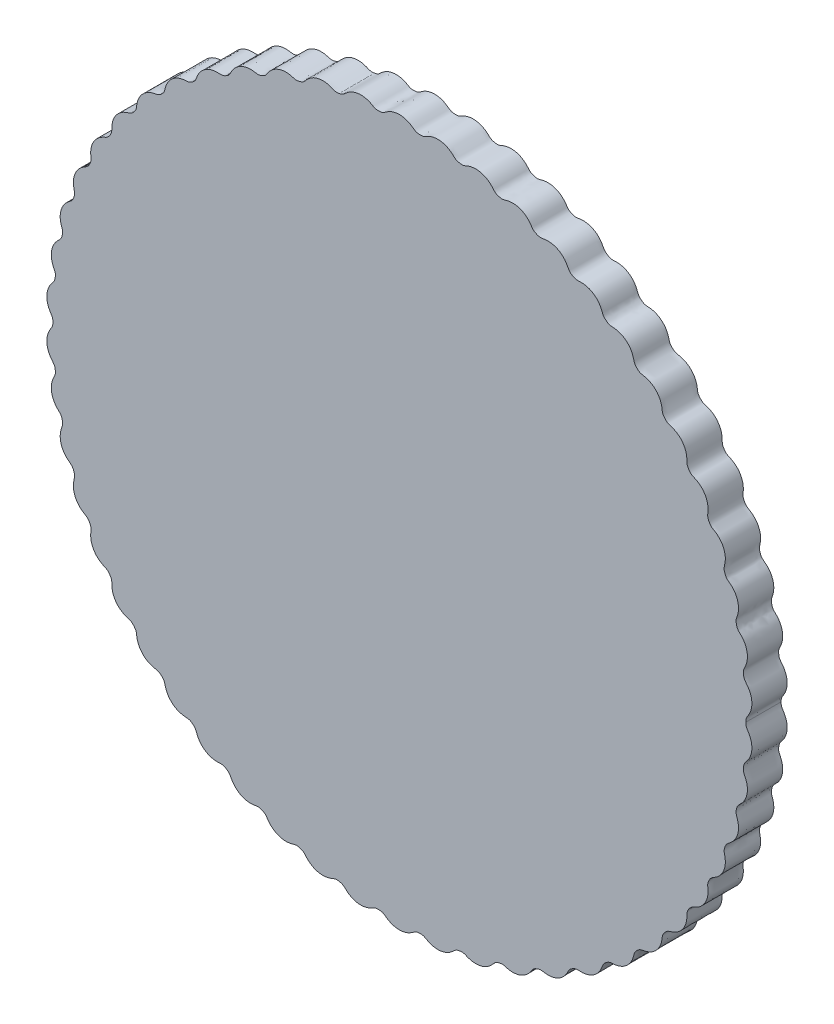
from build123d import *

# Parameters (mm, degrees)
BOSS_EXTRUDE1_DEPTH = 20


with BuildPart() as part:
    # Sketch2 → Boss-Extrude1 (new body)
    with BuildSketch(Plane.XY):
        with BuildLine():
            add(Edge.make_bspline(
                [(196.3825, 0), (196.3825, 0.243288035), (196.398243649, 0.729922422), (196.467671206, 1.796569214), (196.897631399, 2.707361858), (197.506180009, 3.679856694), (198.077913743, 4.570194444), (198.620032332, 5.582427543), (199.095198871, 6.684318292), (199.474773477, 7.892329781), (199.732776133, 9.192715808), (199.850080949, 10.534230409), (199.818921359, 11.900253607), (199.63224692, 13.274365047), (199.284989462, 14.637619624), (198.800550787, 15.904112197), (198.204869255, 17.065047303), (197.520000345, 18.115085043), (196.788829318, 19.067982816), (195.998314098, 19.973352886), (195.36115854, 21.009956982), (195.117532921, 22.191405466), (194.981257086, 23.349056333), (194.940733167, 24.50687874), (195.247204528, 25.588147603), (195.745426342, 26.567704845), (196.207345247, 27.540435347), (196.629204669, 28.600928228), (196.972879737, 29.75357144), (197.209802714, 30.996147902), (197.315021839, 32.318318085), (197.275828509, 33.664080323), (197.086275962, 35.017400133), (196.741348843, 36.360472168), (196.238169422, 37.674232344), (195.60997998, 38.875906815), (194.883544728, 39.959834995), (194.081413646, 40.923287129), (193.244542966, 41.784799015), (192.354305891, 42.592401049), (191.60103892, 43.547794657), (191.217637584, 44.706812578), (190.942703185, 45.866852023), (190.76515684, 47.074658473), (191.009520925, 48.266494985), (191.442614701, 49.387732192), (191.803823829, 50.533194209), (192.088237818, 51.754162255), (192.250937991, 53.048819402), (192.272998064, 54.404605839), (192.133041129, 55.804451325), (191.838509632, 57.159467342), (191.400531154, 58.453909126), (190.831578604, 59.674116122), (190.144162465, 60.808428296), (189.374773062, 61.812504342), (188.550348475, 62.688302851), (187.69741279, 63.446663741), (186.848066326, 64.108618645), (185.963214568, 64.76038142), (185.20406917, 65.589094489), (184.720652935, 66.641949453), (184.322880675, 67.737624605), (184.010359441, 68.902744368), (184.114515222, 70.115042822), (184.41461647, 71.278892874), (184.640354079, 72.458584272), (184.781121365, 73.704296587), (184.792410439, 75.00909677), (184.656929354, 76.358272551), (184.355403968, 77.732406978), (183.905557581, 79.044066717), (183.320264352, 80.278910322), (182.613501814, 81.424815068), (181.799047958, 82.47165343), (180.918294862, 83.379619545), (179.9977707, 84.153786396), (179.062561951, 84.80799972), (178.142110185, 85.366875619), (177.18757644, 85.911506387), (176.337356395, 86.646484594), (175.734979847, 87.636099329), (175.212697059, 88.678187378), (174.767026833, 89.799147517), (174.729739091, 91.01534059), (174.892696417, 92.206160733), (174.979953856, 93.404082017), (174.975150952, 94.657713355), (174.834885638, 95.955001527), (174.543690879, 97.27932627), (174.08467703, 98.609164332), (173.485597942, 99.859731118), (172.760905664, 101.018276756), (171.92589058, 102.074383182), (170.995413253, 103.019590876), (170.015207063, 103.819168455), (169.01103187, 104.481234334), (168.006197137, 105.022452992), (167.027087604, 105.470692046), (166.015780302, 105.900825611), (165.085983379, 106.532129635), (164.372792628, 107.445121301), (163.733062291, 108.419529792), (163.160269998, 109.481171244), (162.982042984, 110.684812013), (163.005652671, 111.886498446), (162.953249934, 113.086449785), (162.80294179, 114.331046934), (162.513018935, 115.603279499), (162.070048412, 116.884843983), (161.459753475, 118.1524019), (160.719543203, 119.324963964), (159.865252095, 120.391544292), (158.913276612, 121.34357037), (157.879358924, 122.174365084), (156.812955246, 122.854741212), (155.73870877, 123.395752814), (154.677836718, 123.816657753), (153.653310196, 124.148198295), (152.598905533, 124.458017839), (151.60210564, 124.977110377), (150.787745367, 125.801132327), (150.039218736, 126.694684058), (149.34705041, 127.682649944), (149.030294339, 128.85746123), (148.914237106, 130.053763208), (148.722882849, 131.239517319), (148.429102125, 132.458249236), (147.993442439, 133.68822143), (147.404686569, 134.909694695), (146.651363735, 136.097830921), (145.780032353, 137.176531373), (144.807695238, 138.136722722), (143.751633191, 138.971793932), (142.628257105, 139.676940592), (141.49007722, 140.228914349), (140.3602868, 140.641555421), (139.257723905, 140.936454623), (138.201635357, 141.146813137), (137.118392347, 141.332128882), (136.068069494, 141.731990098), (135.163552523, 142.455898849), (134.316352138, 143.256510064), (133.514168168, 144.157439841), (133.063166622, 145.287534338), (132.809011943, 146.462273927), (132.481293906, 147.617795519), (132.048013482, 148.794180947), (131.472508515, 149.965259507), (130.745929211, 151.110123222), (129.859765879, 152.202770253), (128.869096649, 153.173021519), (127.791862718, 154.013838948), (126.645995534, 154.720662385), (125.448352786, 155.290625092), (124.253788623, 155.70673198), (123.083732738, 155.985422258), (121.954389271, 156.150327718), (120.881020483, 156.236659466), (119.78358813, 156.294965335), (118.69394613, 156.570187791), (117.711504503, 157.184193719), (116.777087295, 157.881037527), (115.875735842, 158.682747663), (115.296587844, 159.752842782), (114.907772726, 160.890133645), (114.448122732, 161.999796272), (113.881201983, 163.117926615), (113.173634452, 164.214274712), (112.319057452, 165.26704656), (111.312037462, 166.249428218), (110.215427486, 167.098109314), (109.04786448, 167.808182211), (107.827688047, 168.3771993), (106.571974699, 168.804270286), (105.337180691, 169.078883174), (104.142682338, 169.219853851), (103.001830732, 169.252535504), (101.925697176, 169.213672997), (100.82891637, 169.144180503), (99.714690762, 169.291042288), (98.667610317, 169.786842017), (97.658612675, 170.370494799), (96.670282972, 171.062143541), (95.970820505, 172.057768081), (95.452603006, 173.14223031), (94.867237032, 174.191027688), (94.174342589, 175.235782152), (93.34428113, 176.242573558), (92.373263123, 177.189016605), (91.259004692, 178.047847865), (90.071283739, 178.763481836), (88.829180944, 179.333207681), (87.551196056, 179.756723443), (86.254393477, 180.035127305), (84.996068094, 180.164532525), (83.793280815, 180.165877213), (82.656349131, 180.065893098), (81.592003667, 179.902361885), (80.510706486, 179.706010794), (79.386965261, 179.722525854), (78.289405964, 180.093414542), (77.21947285, 180.555983396), (76.157530362, 181.128217382), (75.347212455, 182.035907229), (74.706600577, 183.052875332), (74.003434695, 184.026624276), (73.193936765, 184.983874349), (72.252606537, 185.887493939), (71.178278875, 186.714809166), (69.971850437, 187.438475808), (68.709080395, 188.011384931), (67.409235121, 188.433059161), (66.090724331, 188.705346271), (64.770369551, 188.831318076), (63.505529485, 188.813765642), (62.310718915, 188.675466159), (61.193082204, 188.444168388), (60.154918278, 188.158179947), (59.103727412, 187.837625571), (57.985667241, 187.723570569), (56.852471699, 187.964532584), (55.736072124, 188.299762059), (54.6148778, 188.744842806), (53.704662614, 189.552323011), (52.950319533, 190.488044241), (52.138862854, 191.373576466), (51.22370851, 192.230376982), (50.183839389, 193.01860485), (49.02073051, 193.715604239), (47.738446941, 194.294319913), (46.417704608, 194.716756576), (45.077695033, 194.98467677), (43.736488937, 195.102053011), (42.41043749, 195.073889206), (41.156187533, 194.909616487), (39.985511435, 194.633543094), (38.902283815, 194.274059573), (37.904340814, 193.869481409), (36.897471816, 193.429058695), (35.800212546, 193.185976029), (34.646705284, 193.293752772), (33.498936637, 193.497109466), (32.333652707, 193.809018019), (31.33584934, 194.505368799), (30.477976253, 195.347189129), (29.569202338, 196.132529332), (28.560767471, 196.877293535), (27.436421902, 197.539470252), (26.200260859, 198.096728081), (24.859462844, 198.522666651), (23.498608996, 198.788918121), (22.136556449, 198.899461118), (20.790792559, 198.860339179), (19.476977016, 198.678420631), (18.250278747, 198.369649132), (17.119568506, 197.959535249), (16.085398774, 197.476727376), (15.141172164, 196.959030714), (14.192241211, 196.404695625), (13.130621391, 196.035872571), (11.972401616, 196.009006546), (10.808785499, 196.077740408), (9.615170429, 196.25225874), (8.54327246, 196.828063144), (7.593470629, 197.5645984), (6.599669085, 198.239126201), (5.511591047, 198.861782433), (4.317973876, 199.388953194), (3.025477627, 199.798933507), (1.644297158, 200.066334884), (0.261735008, 200.172800568), (-1.103941085, 200.124471464), (-2.436063621, 199.929380401), (-3.719876159, 199.596167246), (-4.90243375, 199.147072574), (-5.977887217, 198.608464287), (-6.949013691, 198.00886121), (-7.826754864, 197.385047008), (-8.70491511, 196.724295976), (-9.716538894, 196.234720232), (-10.863808245, 196.073574757), (-12.027535921, 196.006756279), (-13.233340535, 196.041524329), (-14.364837524, 196.488995591), (-15.39372366, 197.110285397), (-16.459113371, 197.664878964), (-17.612120191, 198.157006868), (-18.858867339, 198.542042593), (-20.190220001, 198.799201109), (-21.593104826, 198.904449148), (-22.978678497, 198.84968928), (-24.329509711, 198.643141643), (-25.629976221, 198.29471973), (-26.866424391, 197.814718104), (-27.988849242, 197.231373492), (-28.994502271, 196.571554554), (-29.889452667, 195.863264877), (-30.68883846, 195.141769153), (-31.484352387, 194.383537701), (-32.432299658, 193.77982994), (-33.553103737, 193.486584231), (-34.701205551, 193.285117018), (-35.902893269, 193.179664607), (-37.078687723, 193.492751446), (-38.172744243, 193.990393922), (-39.295314554, 194.417553331), (-40.497657716, 194.772497719), (-41.780674726, 195.010191461), (-43.132879538, 195.111050554), (-44.53849711, 195.052721955), (-45.908344795, 194.837477069), (-47.226063454, 194.475504101), (-48.47728736, 193.978463145), (-49.649650322, 193.358164247), (-50.696763562, 192.648458431), (-51.619016422, 191.876351762), (-52.42568807, 191.068953887), (-53.135908161, 190.259533632), (-53.838017809, 189.41407554), (-54.709469207, 188.704399874), (-55.78865106, 188.283019576), (-56.905600904, 187.949628127), (-58.086920963, 187.705381319), (-59.291112279, 187.879849772), (-60.435543945, 188.247115158), (-61.600114018, 188.541063808), (-62.835533894, 188.754024668), (-64.137470161, 188.841162026), (-65.492240874, 188.784357749), (-66.881582626, 188.563241308), (-68.217179485, 188.190422221), (-69.483965705, 187.677918985), (-70.669026349, 187.038980613), (-71.761449906, 186.286772921), (-72.719091124, 185.460303454), (-73.545471927, 184.586350473), (-74.252955978, 183.690763071), (-74.864405859, 182.804364307), (-75.463616398, 181.883112944), (-76.246787037, 181.077066519), (-77.269752583, 180.533250077), (-78.340445627, 180.07244294), (-79.485422697, 179.692704753), (-80.701726255, 179.726195434), (-81.88105659, 179.958117096), (-83.071877616, 180.114879837), (-84.323667263, 180.182977239), (-85.626916353, 180.118379829), (-86.965931974, 179.904680364), (-88.320209526, 179.523766294), (-89.60349374, 178.998414758), (-90.802216726, 178.342311957), (-91.905087571, 177.570116762), (-92.902799872, 176.696172495), (-93.758015821, 175.764116177), (-94.477355567, 174.800135089), (-95.076068252, 173.828470778), (-95.580523142, 172.877076884), (-96.068625436, 171.892498734), (-96.753139959, 171.000969642), (-97.694020553, 170.350082351), (-98.680488576, 169.780544772), (-99.714613803, 169.291161922), (-100.828957905, 169.144119501), (-101.925678743, 169.21369959), (-103.001837469, 169.252525787), (-104.142679789, 169.219857548), (-105.337181773, 169.078881598), (-106.571974196, 168.80427102), (-107.827688284, 168.377198955), (-109.047864362, 167.808182383), (-110.215427547, 167.098109226), (-111.312037431, 166.249428264), (-112.319057468, 165.267046535), (-113.173634443, 164.214274724), (-113.881201987, 163.117926609), (-114.44812273, 161.999796274), (-114.907772727, 160.890133644), (-115.296587844, 159.752842783), (-115.875735842, 158.682747663), (-116.777087294, 157.881037527), (-117.711504503, 157.184193719), (-118.69394613, 156.570187791), (-119.78358813, 156.294965335), (-120.881020483, 156.236659466), (-121.954389271, 156.150327718), (-123.083732738, 155.985422258), (-124.253788623, 155.70673198), (-125.448352786, 155.290625092), (-126.645995534, 154.720662385), (-127.791862718, 154.013838948), (-128.869096649, 153.173021519), (-129.859765879, 152.202770253), (-130.745929211, 151.110123222), (-131.472508515, 149.965259507), (-132.048013482, 148.794180947), (-132.481293906, 147.617795519), (-132.809011943, 146.462273927), (-133.063166622, 145.287534338), (-133.514168168, 144.157439841), (-134.316352138, 143.256510064), (-135.163552523, 142.455898849), (-136.068069494, 141.731990098), (-137.118392347, 141.332128882), (-138.201635357, 141.146813137), (-139.257723905, 140.936454623), (-140.3602868, 140.641555421), (-141.49007722, 140.228914349), (-142.628257105, 139.676940592), (-143.751633191, 138.971793932), (-144.807695238, 138.136722722), (-145.780032353, 137.176531373), (-146.651363735, 136.097830921), (-147.404686569, 134.909694695), (-147.993442439, 133.68822143), (-148.429102125, 132.458249236), (-148.722882849, 131.239517319), (-148.914237106, 130.053763208), (-149.030294339, 128.85746123), (-149.34705041, 127.682649944), (-150.039218736, 126.694684058), (-150.787745367, 125.801132327), (-151.60210564, 124.977110377), (-152.598905533, 124.458017839), (-153.653310196, 124.148198295), (-154.677836718, 123.816657753), (-155.73870877, 123.395752814), (-156.812955246, 122.854741212), (-157.879358924, 122.174365084), (-158.913276612, 121.34357037), (-159.865252095, 120.391544292), (-160.719543203, 119.324963964), (-161.459753475, 118.1524019), (-162.070048412, 116.884843983), (-162.513018935, 115.603279499), (-162.80294179, 114.331046934), (-162.953249934, 113.086449785), (-163.005652671, 111.886498446), (-162.982042984, 110.684812013), (-163.160269998, 109.481171244), (-163.733062291, 108.419529792), (-164.372792628, 107.445121301), (-165.085983379, 106.532129635), (-166.015780302, 105.900825611), (-167.027087604, 105.470692046), (-168.006197137, 105.022452992), (-169.01103187, 104.481234334), (-170.015207063, 103.819168455), (-170.995413253, 103.019590876), (-171.92589058, 102.074383182), (-172.760905664, 101.018276756), (-173.485597942, 99.859731118), (-174.08467703, 98.609164332), (-174.543690879, 97.27932627), (-174.834885638, 95.955001527), (-174.975150952, 94.657713355), (-174.979953856, 93.404082017), (-174.892696417, 92.206160733), (-174.729739091, 91.01534059), (-174.767026833, 89.799147517), (-175.212697059, 88.678187378), (-175.734979847, 87.636099329), (-176.337356395, 86.646484594), (-177.18757644, 85.911506387), (-178.142110185, 85.366875619), (-179.062561951, 84.80799972), (-179.9977707, 84.153786396), (-180.918294862, 83.379619545), (-181.799047958, 82.47165343), (-182.613501814, 81.424815068), (-183.320264352, 80.278910322), (-183.905557581, 79.044066717), (-184.355403968, 77.732406978), (-184.656929354, 76.35827255), (-184.792410439, 75.00909677), (-184.781121365, 73.704296587), (-184.640354079, 72.458584272), (-184.41461647, 71.278892874), (-184.114515222, 70.115042822), (-184.010359441, 68.902744368), (-184.322880675, 67.737624605), (-184.720652935, 66.641949453), (-185.204069169, 65.589094489), (-185.963214569, 64.760381419), (-186.848066325, 64.108618646), (-187.697412794, 63.446663737), (-188.550348465, 62.688302861), (-189.374773086, 61.812504317), (-190.144162412, 60.808428351), (-190.831578707, 59.674116014), (-191.400530948, 58.453909342), (-191.838510041, 57.159466911), (-192.133040326, 55.804452169), (-192.272999635, 54.404604186), (-192.250934898, 53.048822655), (-192.088244101, 51.754155646), (-191.803810259, 50.533208476), (-191.442645196, 49.387700266), (-191.009458381, 48.26655938), (-190.765267603, 47.074549804), (-190.940413532, 45.881026663), (-191.208296077, 44.746581533), (-191.566214623, 43.644724398), (-192.224019237, 42.733483388), (-193.027222903, 41.983402583), (-193.793978121, 41.227320469), (-194.553106222, 40.375067571), (-195.270282373, 39.409481006), (-195.917903259, 38.322873594), (-196.468985866, 37.11642691), (-196.892433707, 35.838419516), (-197.177175749, 34.501883372), (-197.312406915, 33.121837875), (-197.288907438, 31.71520688), (-197.109595265, 30.371154218), (-196.797702859, 29.104128534), (-196.373448943, 27.924457723), (-195.881740562, 26.828623741), (-195.321326289, 25.765353515), (-194.940402776, 24.609752724), (-194.975804852, 23.403966512), (-195.11017503, 22.246092925), (-195.337755653, 21.110134141), (-195.885323802, 20.128688636), (-196.596017429, 19.290431982), (-197.269812337, 18.450451516), (-197.924866987, 17.51582028), (-198.525096031, 16.473532772), (-199.042190652, 15.319022789), (-199.449486847, 14.056890084), (-199.721704434, 12.738099804), (-199.849357678, 11.378072213), (-199.823463118, 9.99061952), (-199.636818407, 8.598264095), (-199.30269202, 7.280113385), (-198.845799059, 6.065921099), (-198.287497845, 4.926328591), (-197.671817389, 3.933583479), (-196.991915363, 2.858869309), (-196.47913381, 1.915457983), (-196.399929512, 0.763136847), (-196.3825, 0.255087934), (-196.3825, 0)],
                knots=[0.075511734, 0.075511734, 0.075511734, 0.075511734, 0.075511734, 0.076969767, 0.0784278, 0.079799271, 0.081170742, 0.082542213, 0.083913685, 0.085597168, 0.087280652, 0.088964135, 0.090647618, 0.092432737, 0.094217855, 0.096002974, 0.097788092, 0.099315521, 0.10084295, 0.10237038, 0.103897809, 0.105426559, 0.106955309, 0.108413342, 0.109871375, 0.111242846, 0.112614317, 0.113985789, 0.11535726, 0.117040743, 0.118724227, 0.12040771, 0.122091194, 0.123876312, 0.125661431, 0.127446549, 0.129231667, 0.130759097, 0.132286526, 0.133813955, 0.135341384, 0.136870134, 0.138398884, 0.139927634, 0.141456385, 0.142983814, 0.144511243, 0.146038672, 0.147566101, 0.14935122, 0.151136338, 0.152921456, 0.154706575, 0.156390058, 0.158073542, 0.159757025, 0.161440509, 0.16281198, 0.164183451, 0.165554922, 0.166926394, 0.168384427, 0.16984246, 0.17137121, 0.17289996, 0.174427389, 0.175954818, 0.177482247, 0.179009677, 0.180794795, 0.182579913, 0.184365032, 0.18615015, 0.187833634, 0.189517117, 0.191200601, 0.192884084, 0.194255555, 0.195627027, 0.196998498, 0.198369969, 0.199828002, 0.201286035, 0.202814785, 0.204343535, 0.205870964, 0.207398393, 0.208925823, 0.210453252, 0.21223837, 0.214023489, 0.215808607, 0.217593725, 0.219277209, 0.220960692, 0.222644176, 0.224327659, 0.225699131, 0.227070602, 0.228442073, 0.229813544, 0.231271577, 0.23272961, 0.23425836, 0.23578711, 0.23731454, 0.238841969, 0.240369398, 0.241896827, 0.243681945, 0.245467064, 0.247252182, 0.249037301, 0.250720784, 0.252404268, 0.254087751, 0.255771235, 0.257142706, 0.258514177, 0.259885648, 0.26125712, 0.262715152, 0.264173185, 0.265701936, 0.267230686, 0.268758115, 0.270285544, 0.271812973, 0.273340402, 0.275125521, 0.276910639, 0.278695758, 0.280480876, 0.282164359, 0.283847843, 0.285531326, 0.28721481, 0.288586281, 0.289957752, 0.291329224, 0.292700695, 0.294158728, 0.295616761, 0.297145511, 0.298674261, 0.30020169, 0.301729119, 0.303256548, 0.304783978, 0.306569096, 0.308354214, 0.310139333, 0.311924451, 0.313607935, 0.315291418, 0.316974902, 0.318658385, 0.320029856, 0.321401328, 0.322772799, 0.32414427, 0.325602303, 0.327060336, 0.328589086, 0.330117836, 0.331645265, 0.333172695, 0.334700124, 0.336227553, 0.338012671, 0.33979779, 0.341582908, 0.343368027, 0.34505151, 0.346734993, 0.348418477, 0.35010196, 0.351473432, 0.352844903, 0.354216374, 0.355587845, 0.357045878, 0.358503911, 0.360032661, 0.361561412, 0.363088841, 0.36461627, 0.366143699, 0.367671128, 0.369456247, 0.371241365, 0.373026483, 0.374811602, 0.376495085, 0.378178569, 0.379862052, 0.381545536, 0.382917007, 0.384288478, 0.385659949, 0.387031421, 0.388489454, 0.389947487, 0.391476237, 0.393004987, 0.394532416, 0.396059845, 0.397587274, 0.399114703, 0.400899822, 0.40268494, 0.404470059, 0.406255177, 0.407938661, 0.409622144, 0.411305628, 0.412989111, 0.414360582, 0.415732053, 0.417103525, 0.418474996, 0.419933029, 0.421391062, 0.422919812, 0.424448562, 0.425975991, 0.42750342, 0.42903085, 0.430558279, 0.432343397, 0.434128516, 0.435913634, 0.437698752, 0.439382236, 0.441065719, 0.442749203, 0.444432686, 0.445804157, 0.447175629, 0.4485471, 0.449918571, 0.451376604, 0.452834637, 0.454363387, 0.455892137, 0.457419567, 0.458946996, 0.460474425, 0.462001854, 0.463786972, 0.465572091, 0.467357209, 0.469142328, 0.470825811, 0.472509295, 0.474192778, 0.475876262, 0.477247733, 0.478619204, 0.479990675, 0.481362146, 0.482820179, 0.484278212, 0.485806962, 0.487335713, 0.488863142, 0.490390571, 0.491918, 0.493445429, 0.495230548, 0.497015666, 0.498800785, 0.500585903, 0.502269386, 0.50395287, 0.505636353, 0.507319837, 0.508691308, 0.510062779, 0.51143425, 0.512805722, 0.514263755, 0.515721788, 0.517250538, 0.518779288, 0.520306717, 0.521834146, 0.523361575, 0.524889005, 0.526674123, 0.528459241, 0.53024436, 0.532029478, 0.533712962, 0.535396445, 0.537079929, 0.538763412, 0.540134883, 0.541506355, 0.542877826, 0.544249297, 0.54570733, 0.547165363, 0.548694113, 0.550222863, 0.551750292, 0.553277722, 0.554805151, 0.55633258, 0.558117698, 0.559902817, 0.561687935, 0.563473053, 0.565156537, 0.56684002, 0.568523504, 0.570206987, 0.571578459, 0.57294993, 0.574321401, 0.575692872, 0.577150905, 0.578608938, 0.580137688, 0.581666438, 0.583193868, 0.584721297, 0.586248726, 0.587776155, 0.589561274, 0.591346392, 0.59313151, 0.594916629, 0.596600112, 0.598283596, 0.599967079, 0.601650563, 0.603022034, 0.604393505, 0.605764976, 0.607136448, 0.608594481, 0.610052513, 0.611581264, 0.613110014, 0.614637443, 0.616164872, 0.617692301, 0.61921973, 0.621004849, 0.622789967, 0.624575086, 0.626360204, 0.628043688, 0.629727171, 0.631410654, 0.633094138, 0.634465609, 0.63583708, 0.637208552, 0.638580023, 0.640038056, 0.641496089, 0.642954122, 0.644412155, 0.645783626, 0.647155097, 0.648526568, 0.64989804, 0.651581523, 0.653265007, 0.65494849, 0.656631973, 0.658417092, 0.66020221, 0.661987329, 0.663772447, 0.665299876, 0.666827305, 0.668354735, 0.669882164, 0.671410914, 0.672939664, 0.674397697, 0.67585573, 0.677227201, 0.678598672, 0.679970144, 0.681341615, 0.683025098, 0.684708582, 0.686392065, 0.688075549, 0.689860667, 0.691645786, 0.693430904, 0.695216022, 0.696743452, 0.698270881, 0.69979831, 0.701325739, 0.702854489, 0.704383239, 0.705841272, 0.707299305, 0.708670776, 0.710042248, 0.711413719, 0.71278519, 0.714468674, 0.716152157, 0.717835641, 0.719519124, 0.721304242, 0.723089361, 0.724874479, 0.726659598, 0.728187027, 0.729714456, 0.731241885, 0.732769314, 0.734298064, 0.735826815, 0.737284848, 0.73874288, 0.740114352, 0.741485823, 0.742857294, 0.744228765, 0.745912249, 0.747595732, 0.749279216, 0.750962699, 0.752747818, 0.754532936, 0.756318055, 0.758103173, 0.759630602, 0.761158031, 0.76268546, 0.76421289, 0.76574164, 0.76727039, 0.768728423, 0.770186456, 0.771557927, 0.772929398, 0.774300869, 0.775672341, 0.777355824, 0.779039308, 0.780722791, 0.782406275, 0.784191393, 0.785976511, 0.78776163, 0.789546748, 0.791074177, 0.792601607, 0.794129036, 0.795656465, 0.797185215, 0.798713965, 0.800171998, 0.801630031, 0.803001502, 0.804372973, 0.805744445, 0.807115916, 0.808799399, 0.810482883, 0.812166366, 0.81384985, 0.815634968, 0.817420087, 0.819205205, 0.820990323, 0.822517753, 0.824045182, 0.825572611, 0.82710004, 0.82862879, 0.83015754, 0.831615573, 0.833073606, 0.834445078, 0.835816549, 0.83718802, 0.838559491, 0.840242975, 0.841926458, 0.843609942, 0.845293425, 0.847078544, 0.848863662, 0.85064878, 0.852433899, 0.853961328, 0.855488757, 0.857016186, 0.858543615, 0.860072366, 0.861601116, 0.863059149, 0.864517182, 0.865888653, 0.867260124, 0.868631595, 0.870003067, 0.87168655, 0.873370033, 0.875053517, 0.876737, 0.878522119, 0.880307237, 0.882092356, 0.883877474, 0.885404903, 0.886932332, 0.888459762, 0.889987191, 0.891515941, 0.893044691, 0.894502724, 0.895960757, 0.897332228, 0.898703699, 0.900075171, 0.901446642, 0.903130125, 0.904813609, 0.906497092, 0.908180576, 0.909965694, 0.911750812, 0.913535931, 0.915321049, 0.916848478, 0.918375908, 0.919903337, 0.921430766, 0.922959516, 0.924488266, 0.924488266, 0.924488266, 0.924488266, 0.924488266], degree=4))
            add(Edge.make_bspline(
                [(-196.3825, 0), (-196.3825, -0.243288035), (-196.398240977, -0.72992252), (-196.467656824, -1.796814189), (-196.897629988, -2.707117426), (-197.506207708, -3.680036411), (-198.077894268, -4.570094576), (-198.620040083, -5.582479712), (-199.095195588, -6.684291942), (-199.474774753, -7.892343185), (-199.732775724, -9.192709271), (-199.850080801, -10.534233588), (-199.818922048, -11.900252366), (-199.632245448, -13.27436484), (-199.284992202, -14.637621351), (-198.800545847, -15.904108186), (-198.204877509, -17.065055009), (-197.519987313, -18.115069897), (-196.78883757, -19.068003455), (-195.998333751, -19.973348673), (-195.361127942, -21.009944075), (-195.117549004, -22.191429762), (-194.981275616, -23.349038079), (-194.940708683, -24.506879836), (-195.247207345, -25.588160511), (-195.745453776, -26.567686614), (-196.207325777, -27.540442156), (-196.629212239, -28.60092723), (-196.972876571, -29.753571604), (-197.209803911, -30.996147824), (-197.315021485, -32.318318383), (-197.275828301, -33.664079666), (-197.086276749, -35.017401446), (-196.741347184, -36.360469646), (-196.238172542, -37.674237128), (-195.609974268, -38.875897665), (-194.883554663, -39.959852481), (-194.081396746, -40.923251662), (-193.244561685, -41.78486272), (-192.354298911, -42.592313518), (-191.601060237, -43.547925112), (-191.221966197, -44.693144058), (-190.952224108, -45.827104749), (-190.777514254, -46.972408022), (-190.956411456, -48.081959806), (-191.337572884, -49.112705574), (-191.683391846, -50.132503761), (-191.979310859, -51.234796243), (-192.186837612, -52.419543841), (-192.27790864, -53.681223791), (-192.228920136, -55.006669321), (-192.033758614, -56.338780996), (-191.688377673, -57.660946506), (-191.189859697, -58.954889482), (-190.537568246, -60.201358727), (-189.774113351, -61.321964697), (-188.926766062, -62.31425803), (-188.018188231, -63.1780182), (-187.086984611, -63.936652732), (-186.10900216, -64.635290636), (-185.249916881, -65.496995053), (-184.740434334, -66.590460307), (-184.340871343, -67.685438416), (-184.034381221, -68.802714983), (-184.083257684, -69.925533071), (-184.342179555, -70.993559447), (-184.567268869, -72.046609254), (-184.733218638, -73.175802529), (-184.801801367, -74.376631673), (-184.745784504, -75.640353296), (-184.543252409, -76.951149419), (-184.194761773, -78.251596962), (-183.698222127, -79.524726182), (-183.05285734, -80.752045573), (-182.260270204, -81.914360224), (-181.371883105, -82.938757354), (-180.415067051, -83.825970138), (-179.412356263, -84.578410423), (-178.399377015, -85.223809197), (-177.346900421, -85.804186329), (-176.393586192, -86.560330496), (-175.760605017, -87.587254816), (-175.236624528, -88.628442642), (-174.80249889, -89.702583253), (-174.720693644, -90.823483458), (-174.853874483, -91.914347216), (-174.955190204, -92.986407952), (-174.988926541, -94.127231618), (-174.917637784, -95.327903154), (-174.715290561, -96.576576782), (-174.361953774, -97.85499723), (-173.864846762, -99.106194318), (-173.223863258, -100.313070359), (-172.440379112, -101.457168777), (-171.518214672, -102.519610521), (-170.516909281, -103.433945598), (-169.463563757, -104.204079802), (-168.380279955, -104.835024737), (-167.299223886, -105.358459843), (-166.186486089, -105.812727598), (-165.151834851, -106.453085962), (-164.403915031, -107.399581957), (-163.762602982, -108.372899222), (-163.206712632, -109.389377968), (-162.995331953, -110.493202037), (-163.000970718, -111.592151116), (-162.977142723, -112.668724998), (-162.878209404, -113.805751372), (-162.668013218, -114.990028278), (-162.322072034, -116.206767743), (-161.822708829, -117.435524071), (-161.183707961, -118.620550411), (-160.406948801, -119.744852345), (-159.495940576, -120.790257821), (-158.456669523, -121.738458957), (-157.355986777, -122.530367166), (-156.220356475, -123.173008047), (-155.071149215, -123.673925185), (-153.936635753, -124.068318061), (-152.778684624, -124.390333246), (-151.676688259, -124.906246058), (-150.823944126, -125.759513995), (-150.073973163, -126.651798252), (-149.403835565, -127.596869001), (-149.065738013, -128.668689608), (-148.94375845, -129.760862608), (-148.795108972, -130.827390821), (-148.564843899, -131.945243572), (-148.218582828, -133.097110533), (-147.733725944, -134.265461521), (-147.095089351, -135.427936909), (-146.322836017, -136.530767051), (-145.420805537, -137.557290623), (-144.394593056, -138.489865842), (-143.252269749, -139.311003577), (-142.067094494, -139.969775718), (-140.864536865, -140.47623266), (-139.664947203, -140.840347955), (-138.492318697, -141.100365113), (-137.304813538, -141.285773026), (-136.150374656, -141.670263451), (-135.204338113, -142.418764344), (-134.355850305, -143.21794898), (-133.580527921, -144.078831272), (-133.120285686, -145.104153882), (-132.872337359, -146.174781035), (-132.600876627, -147.216840615), (-132.242393742, -148.300402702), (-131.764750371, -149.404282694), (-131.147534645, -150.508445262), (-130.378261129, -151.588919224), (-129.483198731, -152.594639283), (-128.468095346, -153.509502524), (-127.340556371, -154.316636005), (-126.110628774, -154.999605858), (-124.856988472, -155.516333168), (-123.603766045, -155.879757211), (-122.370016374, -156.102146629), (-121.175130613, -156.224271784), (-119.974130394, -156.2705651), (-118.782860801, -156.518433564), (-117.756325369, -157.152045222), (-116.820795058, -157.847322636), (-115.950772793, -158.612374515), (-115.374609861, -159.577333397), (-115.004045846, -160.611936309), (-114.613444901, -161.615435187), (-114.131592068, -162.650053293), (-113.529025706, -163.691018232), (-112.787797922, -164.716060475), (-111.898290588, -165.699921455), (-110.892523309, -166.594930793), (-109.77807455, -167.385761745), (-108.564457112, -168.056538393), (-107.263557885, -168.59210437), (-105.958405871, -168.959798999), (-104.67146633, -169.175275454), (-103.420240996, -169.25293156), (-102.21925676, -169.235513178), (-101.021002949, -169.142065861), (-99.809012523, -169.249960368), (-98.715860332, -169.760114281), (-97.705938962, -170.342082037), (-96.752982374, -171.000957489), (-96.068690361, -171.892503231), (-95.580521901, -172.877090672), (-95.07606295, -173.828458248), (-94.477356403, -174.800140936), (-93.758015726, -175.764113558), (-92.902799718, -176.696173539), (-91.905087625, -177.570116504), (-90.802216743, -178.342311655), (-89.603493618, -178.998415687), (-88.320209811, -179.523764398), (-86.965931384, -179.904683887), (-85.626917601, -180.118373396), (-84.323664594, -180.182988315), (-83.071884275, -180.114860943), (-81.881042816, -179.958134578), (-80.70173974, -179.726210341), (-79.485418571, -179.692671804), (-78.34043263, -180.072469015), (-77.269777655, -180.533256999), (-76.246773846, -181.077045863), (-75.463606628, -181.883121838), (-74.864435363, -182.804378951), (-74.25294035, -183.69074961), (-73.545476567, -184.58635654), (-72.719089423, -185.460300768), (-71.761450521, -186.286773975), (-70.669026015, -187.038980346), (-69.483965965, -187.677918694), (-68.217179148, -188.190423125), (-66.881583185, -188.563239459), (-65.49223985, -188.784361178), (-64.137472161, -188.841155782), (-62.835529951, -188.754035359), (-61.600122828, -188.541045815), (-60.435528233, -188.247130922), (-59.291123943, -187.879866143), (-58.08692069, -187.705348113), (-56.905584969, -187.949652517), (-55.788675159, -188.283029361), (-54.709458503, -188.704377826), (-53.838007072, -189.414083239), (-53.135935766, -190.259551603), (-52.42567411, -191.068938703), (-51.619020326, -191.876358327), (-50.696762184, -192.648455565), (-49.64965081, -193.358165364), (-48.477287059, -193.978462841), (-47.226063746, -194.475503842), (-45.908344356, -194.837477928), (-44.53849788, -195.052720184), (-43.132878123, -195.11105384), (-41.780677437, -195.010185491), (-40.497652559, -194.77250788), (-39.295325394, -194.417536482), (-38.172726807, -193.990407756), (-37.078697408, -193.492769061), (-35.902896853, -193.179631595), (-34.701186891, -193.285139393), (-33.553126537, -193.486596747), (-32.432291586, -193.779806798), (-31.484340829, -194.383544101), (-30.688863792, -195.141790207), (-29.889440564, -195.863248175), (-28.994505387, -196.571561528), (-27.988848206, -197.231370486), (-26.866424746, -197.81471927), (-25.629975957, -198.294719393), (-24.329510031, -198.64314142), (-22.978677961, -198.849690083), (-21.593105796, -198.904447479), (-20.190218214, -198.799204209), (-18.858870726, -198.542036978), (-17.612113889, -198.157016361), (-16.459126094, -197.664863488), (-15.393704736, -197.110297113), (-14.364845098, -196.489014211), (-13.233347927, -196.041491955), (-12.02751479, -196.006776337), (-10.863829438, -196.073589836), (-9.716533563, -196.23469631), (-8.704902887, -196.724300991), (-7.826777581, -197.38507086), (-6.949003609, -198.008843216), (-5.977889502, -198.608471575), (-4.902433071, -199.147069468), (-3.719876377, -199.596168446), (-2.436063399, -199.929380036), (-1.103941429, -200.12447128), (0.261735634, -200.172801302), (1.644296001, -200.066333338), (3.025479762, -199.798936379), (4.317969861, -199.388948011), (5.511598408, -198.86179113), (6.599654651, -198.239112306), (7.593490785, -197.56460784), (8.543267099, -196.828082518), (9.615159328, -196.252227443), (10.808808815, -196.077757877), (11.972382317, -196.009023983), (13.130623908, -196.035848192), (14.192253934, -196.404699188), (15.14115237, -196.959057042), (16.085406699, -197.476708333), (17.119567083, -197.959542753), (18.250279062, -198.369645969), (19.47697694, -198.678421848), (20.790792738, -198.860338791), (22.136556086, -198.899460975), (23.498609703, -198.788918778), (24.859461515, -198.52266525), (26.200263313, -198.096730685), (27.436417312, -197.53946557), (28.560775792, -196.877301319), (29.569186389, -196.132517207), (30.477997369, -195.347196165), (31.335846264, -194.505388664), (32.333638048, -193.808988223), (33.498961824, -193.49712411), (34.64668814, -193.293772332), (35.800212216, -193.185951523), (36.897484866, -193.429060757), (37.90432421, -193.869509857), (38.902289476, -194.274039739), (39.985510892, -194.633550712), (41.156187478, -194.909613308), (42.410437556, -195.073890424), (43.736489069, -195.102052605), (45.077694656, -194.98467667), (46.417705387, -194.716757146), (47.738445458, -194.294318676), (49.020733249, -193.715606541), (50.183834286, -193.018600733), (51.223717679, -192.230383748), (52.138845606, -191.373566274), (52.950341323, -190.488048778), (53.704661865, -189.552343099), (54.614859781, -188.744814913), (55.736098841, -188.29977368), (56.852456942, -187.964554001), (57.985664069, -187.723546267), (59.103740613, -187.837626104), (60.154905089, -188.158210131), (61.193085523, -188.444148031), (62.310719261, -188.675473789), (63.505529062, -188.813762492), (64.770369758, -188.831319277), (66.090724415, -188.705345851), (67.409234735, -188.433059106), (68.709081235, -188.011385407), (69.971848821, -187.438474752), (71.178281863, -186.714811134), (72.252600991, -185.887490441), (73.193946658, -184.983880004), (74.003416379, -184.026616156), (74.706622746, -183.052877309), (75.347214044, -182.035927268), (76.157509227, -181.12819177), (77.219500735, -180.555991837), (78.289393793, -180.093437529), (79.386959288, -179.722502084), (80.51071966, -179.70600979), (81.591994071, -179.902393395), (82.656350065, -180.065872493), (83.793282044, -180.165884752), (84.996067307, -180.164529445), (86.254393822, -180.035128475), (87.551196091, -179.756723016), (88.829180554, -179.333207672), (90.071284628, -178.763482211), (91.259002964, -178.047847003), (92.373266319, -177.189018213), (93.344275216, -176.242570728), (94.174353071, -175.23578662), (94.867217898, -174.191021748), (95.452625255, -173.142229699), (95.970824409, -172.0577878), (96.670259007, -171.062120556), (97.658641351, -170.370499945), (98.667600897, -169.78686626), (99.71468207, -169.291019372), (100.828929338, -169.144177977), (101.925691304, -169.213705409), (103.001829268, -169.252514931), (104.142684434, -169.219861195), (105.337179552, -169.078880206), (106.571975177, -168.804271408), (107.827688033, -168.377198873), (109.047864091, -167.808182246), (110.215428413, -167.098109584), (111.312035646, -166.249427563), (112.319060814, -165.267047786), (113.173628249, -164.214272588), (113.881212913, -163.117929836), (114.448103038, -161.999792594), (114.907794754, -160.890130456), (115.296594011, -159.752861915), (115.87570937, -158.682727615), (116.777116374, -157.881039309), (117.711497961, -157.184218893), (118.693934836, -156.570166039), (119.783600717, -156.29496132), (120.881018413, -156.23669234), (121.954385428, -156.150307454), (123.083735672, -155.98542931), (124.253787147, -155.706729165), (125.448353391, -155.29062615), (126.64599547, -154.720661962), (127.791862336, -154.013839029), (128.869097601, -153.173021679), (129.859763999, -152.202769813), (130.745932692, -151.11012405), (131.472502107, -149.965258117), (132.048024712, -148.794182878), (132.481273918, -147.617794153), (132.809033452, -146.462268202), (133.063174968, -145.287552625), (133.514139547, -144.157423001), (134.316381228, -143.256508459), (135.163548948, -142.455924612), (136.068055751, -141.731969804), (137.118404383, -141.332123433), (138.201637118, -141.146846029), (139.257717736, -140.936434941), (140.360290534, -140.641562084), (141.490075427, -140.228911724), (142.628257829, -139.676941573), (143.751633078, -138.97179352), (144.807694868, -138.136722846), (145.780033317, -137.176531422), (146.651361817, -136.097830702), (147.404690123, -134.909695113), (147.993435913, -133.688220794), (148.429113503, -132.45824985), (148.722862838, -131.239518282), (148.914257804, -130.053755025), (149.030304752, -128.857478425), (149.347020028, -127.682636541), (150.039247443, -126.694679086), (150.787744807, -125.801158331), (151.602089635, -124.977091816), (152.598916855, -124.45801103), (153.653315763, -124.14823076), (154.677828305, -123.816638921), (155.738713251, -123.395758999), (156.812953161, -122.854738812), (157.879359757, -122.174365974), (158.913276452, -121.343569974), (159.865251742, -120.391544459), (160.719544166, -119.324963901), (161.459751544, -118.152401905), (162.070051991, -116.884843986), (162.513012379, -115.603279624), (162.802953162, -114.331046222), (162.953230169, -113.086453065), (163.005672279, -111.886487916), (162.982055323, -110.684827882), (163.160238266, -109.481161459), (163.733090226, -108.419521521), (164.37279509, -107.445147194), (165.085965327, -106.532113057), (166.015790757, -105.900817533), (167.027096903, -105.470723645), (168.006186595, -105.022435264), (169.011037039, -104.481239957), (170.015204713, -103.819166314), (170.995414184, -103.019591664), (171.925890375, -102.074382807), (172.760905333, -101.018276962), (173.485598891, -99.859730943), (174.084675113, -98.609164561), (174.543694434, -97.279325857), (174.834879141, -95.955002413), (174.975162165, -94.657711328), (174.979934606, -93.404087569), (174.892714671, -92.206147997), (174.729753188, -91.01535492), (174.76699418, -89.799141482), (175.212723846, -88.67817592), (175.734985299, -87.636124761), (176.33733654, -86.646470224), (177.187585886, -85.911497151), (178.142123089, -85.366905925), (179.062549422, -84.807983335), (179.997776487, -84.153791381), (180.91829228, -83.379617691), (181.799048974, -82.471654105), (182.613501567, -81.424814719), (183.320264047, -80.278910565), (183.905558504, -79.044066433), (184.355402091, -77.732407428), (184.656932837, -76.358271728), (184.792404089, -75.009098403), (184.781132267, -73.704293272), (184.640335603, -72.458592021), (184.414633122, -71.278878105), (184.114530888, -70.115055418), (184.010326307, -68.902742165), (184.32290595, -67.737610115), (184.720661303, -66.641974079), (185.204047781, -65.589082521), (185.963222879, -64.760371149), (186.84808266, -64.108647249), (187.697398448, -63.446648918), (188.550354792, -62.68830714), (189.374770306, -61.812502775), (190.1441635, -60.808428903), (190.831578421, -59.674115696), (191.400530673, -58.453909619), (191.838510924, -57.159466522), (192.133038514, -55.804452834), (192.273002999, -54.404602964), (192.250928781, -53.048825015), (192.088254544, -51.754151088), (191.803792809, -50.533218318), (191.44266002, -49.387683664), (191.009475403, -48.266570073), (190.765234438, -47.074551462), (190.940436954, -45.881009336), (191.208307247, -44.746605022), (191.56619199, -43.644714995), (192.224026299, -42.733472222), (193.027242448, -41.983429096), (193.793962151, -41.227307416), (194.553113002, -40.375071086), (195.270279433, -39.409479798), (195.917904403, -38.322874016), (196.468985545, -37.116426627), (196.892433466, -35.838419823), (197.177176581, -34.501882883), (197.312405192, -33.121838747), (197.288910636, -31.715205276), (197.109589463, -30.371157272), (196.797712703, -29.104122794), (196.373432753, -27.924469524), (195.881753359, -26.82860553), (195.321344437, -25.765362159), (194.940370028, -24.609758221), (194.975826104, -23.403946581), (195.110188851, -22.246114962), (195.337732081, -21.110127421), (195.88532952, -20.128676743), (196.59603992, -19.290455999), (197.26979496, -18.450440529), (197.924874129, -17.515822688), (198.525092972, -16.473532562), (199.042191833, -15.31902179), (199.449486504, -14.056892166), (199.721704212, -12.738095842), (199.849358485, -11.378079517), (199.823461431, -9.990606319), (199.636821553, -8.598287772), (199.302686297, -7.280071897), (198.845808835, -6.065992425), (198.287481629, -4.926209817), (197.671831494, -3.933772169), (196.991927219, -2.858626765), (196.479113301, -1.915681582), (196.399926228, -0.763132264), (196.3825, -0.255087934), (196.3825, 0)],
                knots=[0.075511734, 0.075511734, 0.075511734, 0.075511734, 0.075511734, 0.076969767, 0.0784278, 0.079799271, 0.081170742, 0.082542213, 0.083913685, 0.085597168, 0.087280652, 0.088964135, 0.090647618, 0.092432737, 0.094217855, 0.096002974, 0.097788092, 0.099315521, 0.10084295, 0.10237038, 0.103897809, 0.105426559, 0.106955309, 0.108413342, 0.109871375, 0.111242846, 0.112614317, 0.113985789, 0.11535726, 0.117040743, 0.118724227, 0.12040771, 0.122091194, 0.123876312, 0.125661431, 0.127446549, 0.129231667, 0.130759097, 0.132286526, 0.133813955, 0.135341384, 0.136870134, 0.138398884, 0.139856917, 0.14131495, 0.142686421, 0.144057893, 0.145429364, 0.146800835, 0.148484319, 0.150167802, 0.151851286, 0.153534769, 0.155319887, 0.157105006, 0.158890124, 0.160675243, 0.162202672, 0.163730101, 0.16525753, 0.166784959, 0.168313709, 0.16984246, 0.171300493, 0.172758526, 0.174129997, 0.175501468, 0.176872939, 0.17824441, 0.179927894, 0.181611377, 0.183294861, 0.184978344, 0.186763463, 0.188548581, 0.1903337, 0.192118818, 0.193646247, 0.195173676, 0.196701105, 0.198228535, 0.199757285, 0.201286035, 0.202744068, 0.204202101, 0.205573572, 0.206945043, 0.208316514, 0.209687986, 0.211371469, 0.213054953, 0.214738436, 0.21642192, 0.218207038, 0.219992156, 0.221777275, 0.223562393, 0.225089822, 0.226617252, 0.228144681, 0.22967211, 0.23120086, 0.23272961, 0.234187643, 0.235645676, 0.237017147, 0.238388619, 0.23976009, 0.241131561, 0.242815044, 0.244498528, 0.246182011, 0.247865495, 0.249650613, 0.251435732, 0.25322085, 0.255005969, 0.256533398, 0.258060827, 0.259588256, 0.261115685, 0.262644435, 0.264173185, 0.265631218, 0.267089251, 0.268460723, 0.269832194, 0.271203665, 0.272575136, 0.27425862, 0.275942103, 0.277625587, 0.27930907, 0.281094189, 0.282879307, 0.284664425, 0.286449544, 0.287976973, 0.289504402, 0.291031831, 0.29255926, 0.294088011, 0.295616761, 0.297074794, 0.298532827, 0.299904298, 0.301275769, 0.30264724, 0.304018712, 0.305702195, 0.307385678, 0.309069162, 0.310752645, 0.312537764, 0.314322882, 0.316108001, 0.317893119, 0.319420548, 0.320947977, 0.322475407, 0.324002836, 0.325531586, 0.327060336, 0.328518369, 0.329976402, 0.331347873, 0.332719344, 0.334090816, 0.335462287, 0.33714577, 0.338829254, 0.340512737, 0.342196221, 0.343981339, 0.345766458, 0.347551576, 0.349336694, 0.350864124, 0.352391553, 0.353918982, 0.355446411, 0.356975161, 0.358503911, 0.359961944, 0.361419977, 0.362791448, 0.36416292, 0.365534391, 0.366905862, 0.368589346, 0.370272829, 0.371956312, 0.373639796, 0.375424914, 0.377210033, 0.378995151, 0.38078027, 0.382307699, 0.383835128, 0.385362557, 0.386889986, 0.388418736, 0.389947487, 0.391405519, 0.392863552, 0.394235024, 0.395606495, 0.396977966, 0.398349437, 0.400032921, 0.401716404, 0.403399888, 0.405083371, 0.40686849, 0.408653608, 0.410438726, 0.412223845, 0.413751274, 0.415278703, 0.416806132, 0.418333562, 0.419862312, 0.421391062, 0.422849095, 0.424307128, 0.425678599, 0.42705007, 0.428421541, 0.429793013, 0.431476496, 0.43315998, 0.434843463, 0.436526947, 0.438312065, 0.440097183, 0.441882302, 0.44366742, 0.445194849, 0.446722278, 0.448249708, 0.449777137, 0.451305887, 0.452834637, 0.45429267, 0.455750703, 0.457122174, 0.458493645, 0.459865117, 0.461236588, 0.462920071, 0.464603555, 0.466287038, 0.467970522, 0.46975564, 0.471540759, 0.473325877, 0.475110995, 0.476638425, 0.478165854, 0.479693283, 0.481220712, 0.482749462, 0.484278212, 0.485736245, 0.487194278, 0.48856575, 0.489937221, 0.491308692, 0.492680163, 0.494363647, 0.49604713, 0.497730614, 0.499414097, 0.501199215, 0.502984334, 0.504769452, 0.506554571, 0.508082, 0.509609429, 0.511136858, 0.512664287, 0.514193038, 0.515721788, 0.517179821, 0.518637854, 0.520009325, 0.521380796, 0.522752267, 0.524123738, 0.525807222, 0.527490705, 0.529174189, 0.530857672, 0.532642791, 0.534427909, 0.536213028, 0.537998146, 0.539525575, 0.541053004, 0.542580433, 0.544107863, 0.545636613, 0.547165363, 0.548623396, 0.550081429, 0.5514529, 0.552824371, 0.554195843, 0.555567314, 0.557250797, 0.558934281, 0.560617764, 0.562301248, 0.564086366, 0.565871484, 0.567656603, 0.569441721, 0.57096915, 0.57249658, 0.574024009, 0.575551438, 0.577080188, 0.578608938, 0.580066971, 0.581525004, 0.582896475, 0.584267947, 0.585639418, 0.587010889, 0.588694372, 0.590377856, 0.592061339, 0.593744823, 0.595529941, 0.59731506, 0.599100178, 0.600885297, 0.602412726, 0.603940155, 0.605467584, 0.606995013, 0.608523763, 0.610052513, 0.611510546, 0.612968579, 0.614340051, 0.615711522, 0.617082993, 0.618454464, 0.620137948, 0.621821431, 0.623504915, 0.625188398, 0.626973517, 0.628758635, 0.630543753, 0.632328872, 0.633856301, 0.63538373, 0.636911159, 0.638438588, 0.639967339, 0.641496089, 0.642954122, 0.644412155, 0.645783626, 0.647155097, 0.648526568, 0.64989804, 0.651581523, 0.653265007, 0.65494849, 0.656631973, 0.658417092, 0.66020221, 0.661987329, 0.663772447, 0.665299876, 0.666827305, 0.668354735, 0.669882164, 0.671410914, 0.672939664, 0.674397697, 0.67585573, 0.677227201, 0.678598672, 0.679970144, 0.681341615, 0.683025098, 0.684708582, 0.686392065, 0.688075549, 0.689860667, 0.691645786, 0.693430904, 0.695216022, 0.696743452, 0.698270881, 0.69979831, 0.701325739, 0.702854489, 0.704383239, 0.705841272, 0.707299305, 0.708670776, 0.710042248, 0.711413719, 0.71278519, 0.714468674, 0.716152157, 0.717835641, 0.719519124, 0.721304242, 0.723089361, 0.724874479, 0.726659598, 0.728187027, 0.729714456, 0.731241885, 0.732769314, 0.734298064, 0.735826815, 0.737284848, 0.73874288, 0.740114352, 0.741485823, 0.742857294, 0.744228765, 0.745912249, 0.747595732, 0.749279216, 0.750962699, 0.752747818, 0.754532936, 0.756318055, 0.758103173, 0.759630602, 0.761158031, 0.76268546, 0.76421289, 0.76574164, 0.76727039, 0.768728423, 0.770186456, 0.771557927, 0.772929398, 0.774300869, 0.775672341, 0.777355824, 0.779039308, 0.780722791, 0.782406275, 0.784191393, 0.785976511, 0.78776163, 0.789546748, 0.791074177, 0.792601607, 0.794129036, 0.795656465, 0.797185215, 0.798713965, 0.800171998, 0.801630031, 0.803001502, 0.804372973, 0.805744445, 0.807115916, 0.808799399, 0.810482883, 0.812166366, 0.81384985, 0.815634968, 0.817420087, 0.819205205, 0.820990323, 0.822517753, 0.824045182, 0.825572611, 0.82710004, 0.82862879, 0.83015754, 0.831615573, 0.833073606, 0.834445078, 0.835816549, 0.83718802, 0.838559491, 0.840242975, 0.841926458, 0.843609942, 0.845293425, 0.847078544, 0.848863662, 0.85064878, 0.852433899, 0.853961328, 0.855488757, 0.857016186, 0.858543615, 0.860072366, 0.861601116, 0.863059149, 0.864517182, 0.865888653, 0.867260124, 0.868631595, 0.870003067, 0.87168655, 0.873370033, 0.875053517, 0.876737, 0.878522119, 0.880307237, 0.882092356, 0.883877474, 0.885404903, 0.886932332, 0.888459762, 0.889987191, 0.891515941, 0.893044691, 0.894502724, 0.895960757, 0.897332228, 0.898703699, 0.900075171, 0.901446642, 0.903130125, 0.904813609, 0.906497092, 0.908180576, 0.909965694, 0.911750812, 0.913535931, 0.915321049, 0.916848478, 0.918375908, 0.919903337, 0.921430766, 0.922959516, 0.924488266, 0.924488266, 0.924488266, 0.924488266, 0.924488266], degree=4))
        make_face()
    extrude(amount=BOSS_EXTRUDE1_DEPTH)


solid = part.part
